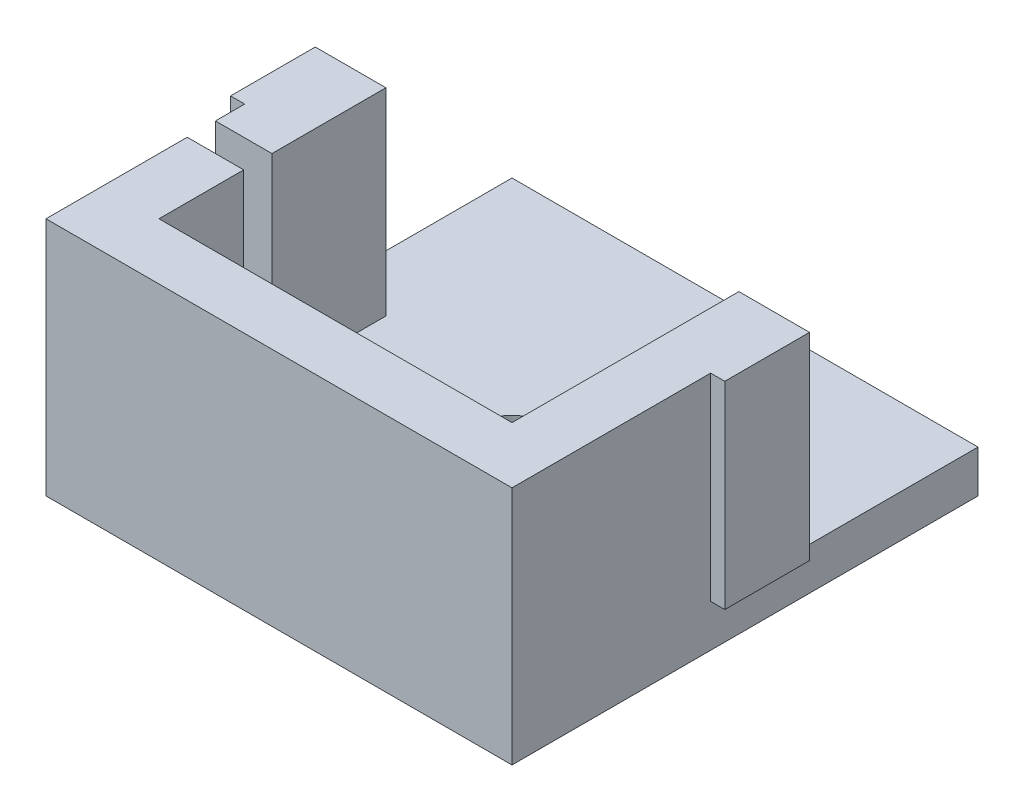
from build123d import *

# Parameters (mm, degrees)
SKETCH1_W           = 33
SKETCH1_H           = 33
SKETCH1_R           = 2.75
BOSS_EXTRUDE1_DEPTH = 17
SKETCH2_W           = 25
SKETCH2_H           = 25
CUT_EXTRUDE2_DEPTH  = 14
SKETCH3_W           = 4
SKETCH3_H           = 3
CUT_EXTRUDE3_DEPTH  = 14
SKETCH4_W           = 15.227626713
SKETCH4_H           = 4
CUT_EXTRUDE4_DEPTH  = 14
SKETCH5_W           = 4
SKETCH5_H           = 9.93135505
CUT_EXTRUDE5_DEPTH  = 14
SKETCH6_W           = 27.732245768
SKETCH6_H           = 12.796931656
CUT_EXTRUDE6_DEPTH  = 14
SKETCH7_W           = 1
SKETCH7_H           = 6
BOSS_EXTRUDE2_DEPTH = 14
SKETCH8_W           = 4
SKETCH8_H           = 2
CUT_EXTRUDE7_DEPTH  = 14


with BuildPart() as part:
    # Sketch1 → Boss-Extrude1 (new body)
    with BuildSketch(Plane(origin=(0, 0, 0), x_dir=(1, 0, 0), z_dir=(0, 1, 0))):
        with Locations((-1.794117647, -1.647058824)):
            Rectangle(SKETCH1_W, SKETCH1_H)
        with Locations(Location((-1.794117647, -1.647058824, 0), (0, 0, 270))):
            Circle(SKETCH1_R, mode=Mode.SUBTRACT)
    extrude(amount=BOSS_EXTRUDE1_DEPTH)

    # Sketch2 → Cut-Extrude2 (cut)
    with BuildSketch(Plane(origin=(0, 17, 0), x_dir=(1, 0, 0), z_dir=(0, 1, 0))):
        with Locations((-1.794117647, -1.647058824)):
            Rectangle(SKETCH2_W, SKETCH2_H)
    extrude(amount=-CUT_EXTRUDE2_DEPTH, mode=Mode.SUBTRACT)

    # Sketch3 → Cut-Extrude3 (cut)
    with BuildSketch(Plane(origin=(0, 17, 0), x_dir=(1, 0, 0), z_dir=(0, 1, 0))):
        with Locations((12.705882353, 3.421586126)):
            Rectangle(SKETCH3_W, SKETCH3_H)
        with Locations((-16.294117647, 3.421586126)):
            Rectangle(SKETCH3_W, SKETCH3_H)
    extrude(amount=-CUT_EXTRUDE3_DEPTH, mode=Mode.SUBTRACT)

    # Sketch4 → Cut-Extrude4 (cut)
    with BuildSketch(Plane(origin=(0, 17, 0), x_dir=(1, 0, 0), z_dir=(0, 1, 0))):
        with Locations((3.092068996, 12.852941176)):
            Rectangle(SKETCH4_W, SKETCH4_H)
    extrude(amount=-CUT_EXTRUDE4_DEPTH, mode=Mode.SUBTRACT)

    # Sketch5 → Cut-Extrude5 (cut)
    with BuildSketch(Plane(origin=(0, 17, 0), x_dir=(1, 0, 0), z_dir=(0, 1, 0))):
        with Locations((12.705882353, 9.887263651)):
            Rectangle(SKETCH5_W, SKETCH5_H)
    extrude(amount=-CUT_EXTRUDE5_DEPTH, mode=Mode.SUBTRACT)

    # Sketch6 → Cut-Extrude6 (cut)
    with BuildSketch(Plane(origin=(0, 17, 0), x_dir=(1, 0, 0), z_dir=(0, 1, 0))):
        with Locations((-12.170590875, 9.919039286)):
            Rectangle(SKETCH6_W, SKETCH6_H)
    extrude(amount=-CUT_EXTRUDE6_DEPTH, mode=Mode.SUBTRACT)

    # Sketch7 → Boss-Extrude2 (add)
    with BuildSketch(Plane(origin=(0, 3, 0), x_dir=(1, 0, 0), z_dir=(0, 1, 0))):
        with Locations((15.205882353, -1.078413874)):
            Rectangle(SKETCH7_W, SKETCH7_H)
        with Locations((-18.794117647, -1.078413874)):
            Rectangle(SKETCH7_W, SKETCH7_H)
    extrude(amount=BOSS_EXTRUDE2_DEPTH)

    # Sketch8 → Cut-Extrude7 (cut)
    with BuildSketch(Plane(origin=(0, 17, 0), x_dir=(1, 0, 0), z_dir=(0, 1, 0))):
        with Locations((-16.294117647, -7.147058824)):
            Rectangle(SKETCH8_W, SKETCH8_H)
    extrude(amount=-CUT_EXTRUDE7_DEPTH, mode=Mode.SUBTRACT)


solid = part.part
